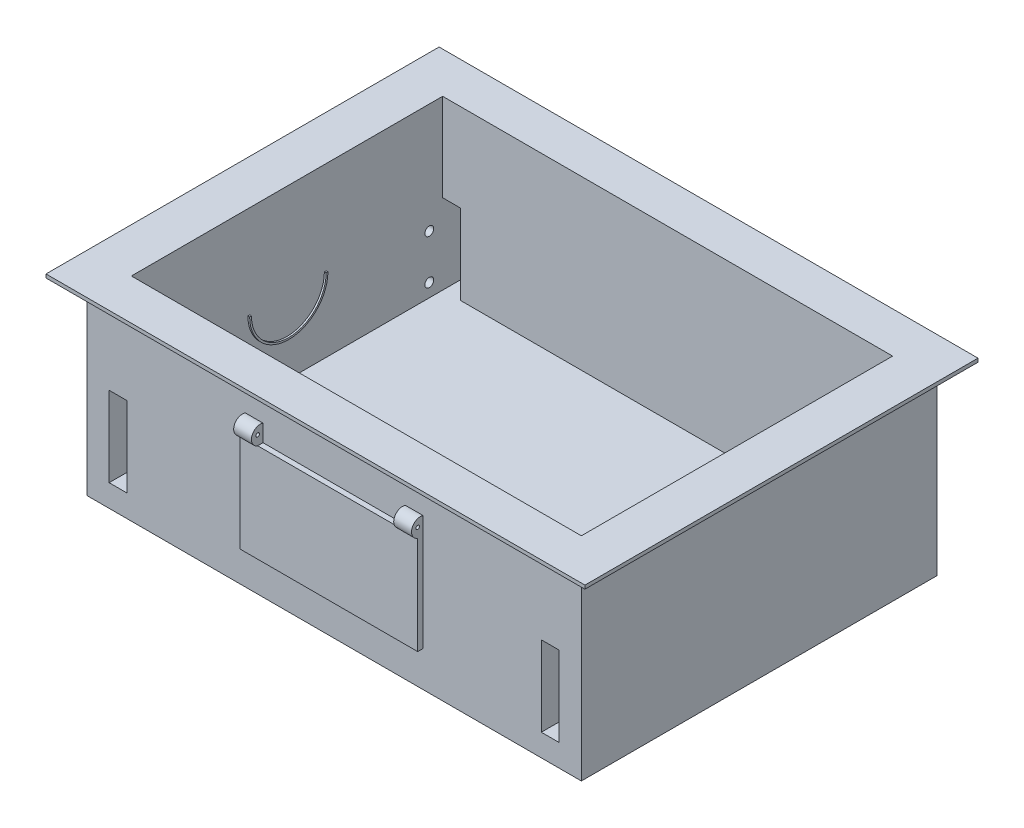
from build123d import *

# Parameters (mm, degrees)
SKETCH2_W                   = 1390
SKETCH2_H                   = 1000
SKETCH2_W_2                 = 1265
SKETCH2_H_2                 = 875
BOSS_EXTRUDE1_DEPTH         = 534.5
SKETCH3_W                   = 1390
SKETCH3_H                   = 1000
BOSS_EXTRUDE2_DEPTH         = 62.5
MMRTG_START                 = -62.5
MMRTG_HOLDER_DEPTH          = 5
SKETCH5_R                   = 12.5
SUSPENSION_BOLT_HOLES_DEPTH = 1571.920192117
CONTROL_ARM_CUTOUT_REACH    = 1331.931
SKETCH6_W                   = 50
SKETCH6_H                   = 225
MIRROR3_COPY_1_REACH        = 1331.931
MIRROR3_COPY_1_SKETCH_W     = 50
MIRROR3_COPY_1_SKETCH_H     = 225
SKETCH7_W                   = 1515
SKETCH7_H                   = 1105
SKETCH7_W_2                 = 1265
SKETCH7_H_2                 = 875
ATTACHROVERFLANGE_DEPTH     = 10
SKETCH11_R                  = 12.5
BOSS_EXTRUDE3_DEPTH         = 5
SKETCH13_R                  = 25
SKETCH13_W                  = 15
SKETCH13_H                  = 300
BOSS_EXTRUDE4_DEPTH         = 250
CUT_EXTRUDE1_DEPTH          = 250
CUT_EXTRUDE1_DEPTH_BACK     = 15
SKETCH14_W                  = 400
SKETCH14_H                  = 55.53291541
CUT_EXTRUDE2_REACH          = 1269.282
SKETCH15_R                  = 5
SKETCH16_W                  = 400
SKETCH16_H                  = 66.742444313
CUT_EXTRUDE3_DEPTH          = 607


with BuildPart() as part:
    # Sketch2 → Boss-Extrude1 (new body)
    with BuildSketch(Plane(origin=(0, 0, 0), x_dir=(1, 0, 0), z_dir=(0, 1, 0))):
        Rectangle(SKETCH2_W, SKETCH2_H)
        Rectangle(SKETCH2_W_2, SKETCH2_H_2, mode=Mode.SUBTRACT)
    extrude(amount=-BOSS_EXTRUDE1_DEPTH)

    # Sketch3 → Boss-Extrude2 (add)
    with BuildSketch(Plane.XZ.offset(534.5)):
        Rectangle(SKETCH3_W, SKETCH3_H)
    extrude(amount=-BOSS_EXTRUDE2_DEPTH)

    # Sketch4 → MMRTG Holder (add)
    with BuildSketch(Plane(origin=(695, 0, 0), x_dir=(0, 0, -1), z_dir=(1, 0, 0)).offset(MMRTG_START)):
        with BuildLine():
            Line((-105, -261), (-110, -261))
            ThreePointArc((-110, -261), (0, -371), (110, -261))
            Line((110, -261), (105, -261))
            ThreePointArc((105, -261), (0, -366), (-105, -261))
        make_face()
    mmrtg_holder = extrude(amount=-MMRTG_HOLDER_DEPTH)

    # Mirror1: MMRTG Holder across plane
    add(mmrtg_holder.mirror(Plane(origin=(0, 0, 0), x_dir=(0, 0, 1), z_dir=(1, 0, 0))))

    # Sketch5 → Suspension Bolt Holes (cut, through all)
    with BuildSketch(Plane(origin=(695, 0, 0), x_dir=(0, 0, -1), z_dir=(1, 0, 0))):
        with Locations((-400, -309.5)):
            Circle(SKETCH5_R)
        with Locations((-400, -434.5)):
            Circle(SKETCH5_R)
        with Locations((400, -434.5)):
            Circle(SKETCH5_R)
        with Locations((400, -309.5)):
            Circle(SKETCH5_R)
    extrude(amount=-SUSPENSION_BOLT_HOLES_DEPTH, mode=Mode.SUBTRACT)

    # Sketch6 → Control Arm Cutout (cut, up to next)
    with BuildSketch(Plane(origin=(0, 0, -500), x_dir=(-1, 0, 0), z_dir=(0, 0, -1)), mode=Mode.PRIVATE) as control_arm_cutout_sk1:
        with Locations((-607.5, -359.5)):
            Rectangle(SKETCH6_W, SKETCH6_H)
    control_arm_cutout_tool1 = extrude(control_arm_cutout_sk1.sketch, amount=-CONTROL_ARM_CUTOUT_REACH, mode=Mode.PRIVATE) & part.part
    control_arm_cutout = control_arm_cutout_tool1.solids().sort_by_distance((607.5, -359.5, -500))[0]
    add(control_arm_cutout, mode=Mode.SUBTRACT)

    # Mirror2: Control Arm Cutout across plane
    add(control_arm_cutout.mirror(Plane(origin=(0, 0, 0), x_dir=(0, 0, 1), z_dir=(1, 0, 0))), mode=Mode.SUBTRACT)

    # Mirror3: Control Arm Cutout across plane
    add(control_arm_cutout.mirror(Plane.XY), mode=Mode.SUBTRACT)

    # Mirror3 copy 1 sketch → Mirror3 copy 1 (cut, up to next)
    with BuildSketch(Plane.XY.offset(500), mode=Mode.PRIVATE) as mirror3_copy_1_sk1:
        with Locations((-607.5, -359.5)):
            Rectangle(MIRROR3_COPY_1_SKETCH_W, MIRROR3_COPY_1_SKETCH_H)
    mirror3_copy_1_tool1 = extrude(mirror3_copy_1_sk1.sketch, amount=-MIRROR3_COPY_1_REACH, mode=Mode.PRIVATE) & part.part
    add(mirror3_copy_1_tool1.solids().sort_by_distance((-607.5, -359.5, 500))[0], mode=Mode.SUBTRACT)

    # Sketch7 → AttachRoverFlange (add)
    with BuildSketch(Plane(origin=(0, 0, 0), x_dir=(1, 0, 0), z_dir=(0, 1, 0))):
        Rectangle(SKETCH7_W, SKETCH7_H)
        Rectangle(SKETCH7_W_2, SKETCH7_H_2, mode=Mode.SUBTRACT)
    extrude(amount=-ATTACHROVERFLANGE_DEPTH)

    # Sketch11 → Boss-Extrude3 (add)
    with BuildSketch(Plane(origin=(695, 0, 0), x_dir=(0, 0, -1), z_dir=(1, 0, 0))):
        with Locations((-400, -309.5)):
            Circle(SKETCH11_R)
        with Locations((-400, -434.5)):
            Circle(SKETCH11_R)
        with Locations((400, -309.5)):
            Circle(SKETCH11_R)
        with Locations((400, -434.5)):
            Circle(SKETCH11_R)
    boss_extrude3 = extrude(amount=-BOSS_EXTRUDE3_DEPTH)

    # Mirror4: Boss-Extrude3 across plane
    add(boss_extrude3.mirror(Plane(origin=(0, 0, 0), x_dir=(0, 0, 1), z_dir=(1, 0, 0))))

    # Sketch13 → Boss-Extrude4 (add, symmetric)
    with BuildSketch(Plane(origin=(0, 0, 0), x_dir=(0, 0, -1), z_dir=(1, 0, 0))):
        with Locations((507.5, -134.5)):
            Circle(SKETCH13_R)
        with Locations((507.5, -284.5)):
            Rectangle(SKETCH13_W, SKETCH13_H)
    boss_extrude4 = extrude(amount=BOSS_EXTRUDE4_DEPTH, both=True)

    # Sketch14 → Cut-Extrude1 (cut, two sides: drawn at the far end of the back side and taken through both)
    with BuildSketch(Plane(origin=(0, 0, -515), x_dir=(-1, 0, 0), z_dir=(0, 0, -1)).offset(-CUT_EXTRUDE1_DEPTH_BACK)):
        with Locations((0, -130.58202233)):
            Rectangle(SKETCH14_W, SKETCH14_H)
    extrude(amount=CUT_EXTRUDE1_DEPTH + CUT_EXTRUDE1_DEPTH_BACK, mode=Mode.SUBTRACT)

    # Cut-Extrude2: up to this face of the body (flat: up to its plane)
    cut_extrude2_end = Plane(part.part.faces().sort_by_distance((-695, -272.25, 0))[0])
    # Sketch15 → Cut-Extrude2 (cut, up to the picked face)
    with BuildSketch(Plane(origin=(250, 0, 0), x_dir=(0, 0, -1), z_dir=(1, 0, 0)), mode=Mode.PRIVATE) as cut_extrude2_sk1:
        with Locations((515, -132.090441405)):
            Circle(SKETCH15_R)
    cut_extrude2_tool1 = split(extrude(cut_extrude2_sk1.sketch, amount=-CUT_EXTRUDE2_REACH, mode=Mode.PRIVATE), bisect_by=cut_extrude2_end, keep=Keep.BOTH, mode=Mode.PRIVATE)
    cut_extrude2 = cut_extrude2_tool1.solids().sort_by(Axis((250, -132.090441, -515), (-1, 0, 0)))[0]
    add(cut_extrude2, mode=Mode.SUBTRACT)

    # Mirror6: Boss-Extrude4, Cut-Extrude2 across plane
    add(boss_extrude4.mirror(Plane.XY))
    add(cut_extrude2.mirror(Plane.XY), mode=Mode.SUBTRACT)

    # Sketch16 → Cut-Extrude3 (cut)
    with BuildSketch(Plane.XY.offset(500)):
        with Locations((0, -124.977257879)):
            Rectangle(SKETCH16_W, SKETCH16_H)
    extrude(amount=CUT_EXTRUDE3_DEPTH, mode=Mode.SUBTRACT)


solid = part.part
